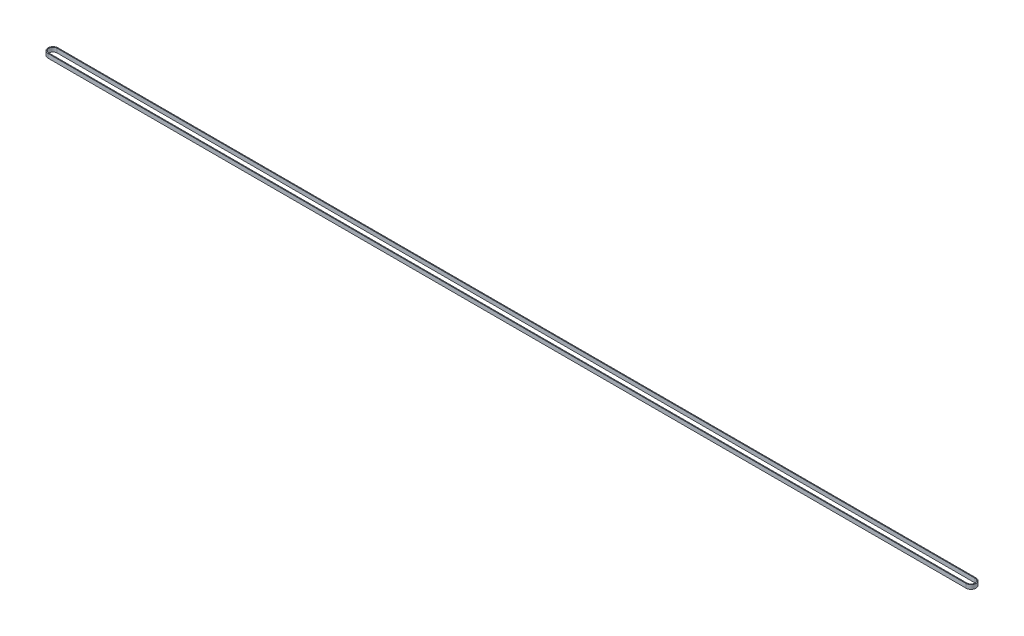
from build123d import *

# Parameters (mm, degrees)
BOSS_EXTRUDE1_DEPTH = 2.5


with BuildPart() as part:
    # Sketch1 → Boss-Extrude1 (new, symmetric)
    with BuildSketch(Plane(origin=(0, 0, 0), x_dir=(1, 0, 0), z_dir=(0, 1, 0))):
        with BuildLine():
            Line((-557.95, 6), (557.95, 6))
            ThreePointArc((557.95, 6), (563.95, 0), (557.95, -6))
            Line((557.95, -6), (-557.95, -6))
            ThreePointArc((-557.95, -6), (-563.95, 0), (-557.95, 6))
        make_face()
        with BuildLine():
            Line((-557.95, 5), (557.95, 5))
            ThreePointArc((557.95, 5), (562.95, 0), (557.95, -5))
            Line((557.95, -5), (-557.95, -5))
            ThreePointArc((-557.95, -5), (-562.95, 0), (-557.95, 5))
        make_face(mode=Mode.SUBTRACT)
    extrude(amount=BOSS_EXTRUDE1_DEPTH, both=True)


solid = part.part
